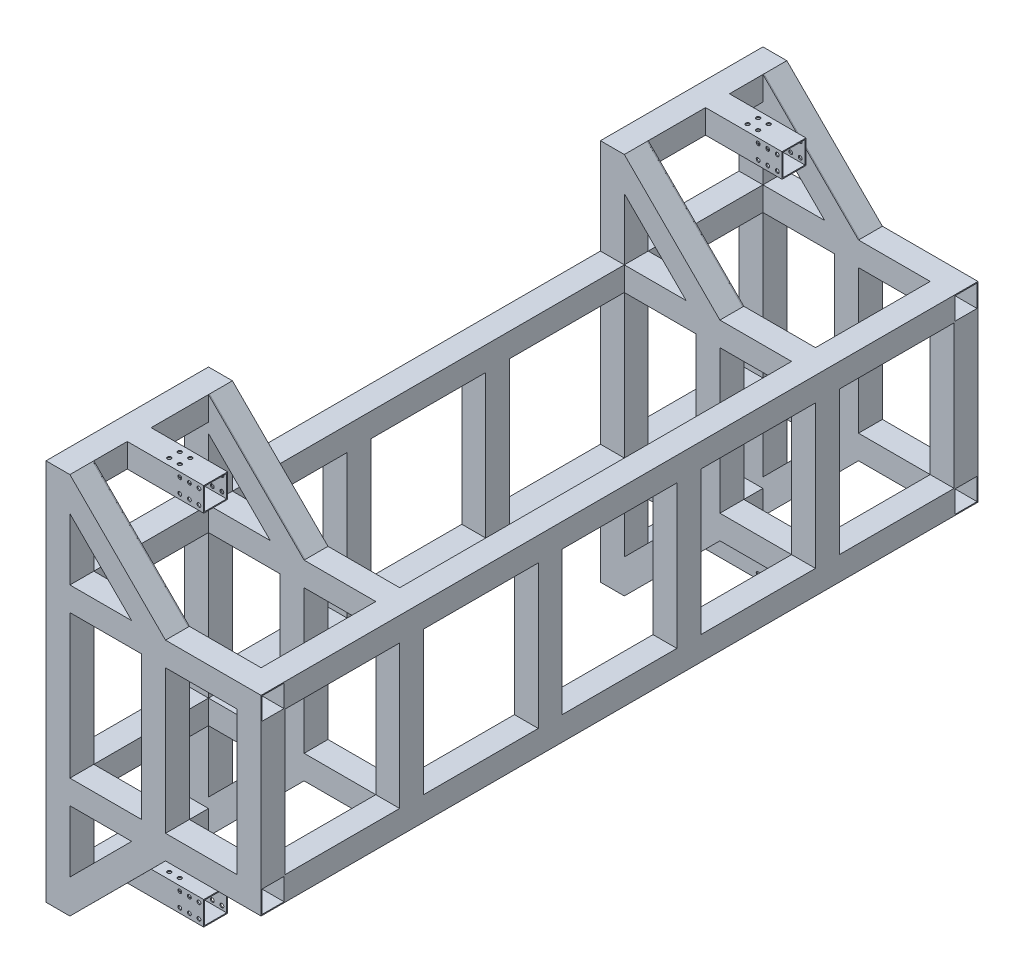
from build123d import *

# Parameters (mm, degrees)
BOSS_EXTRUDE1_DEPTH        = 100
BOSS_EXTRUDE1_DEPTH_BACK   = 125
SKETCH1_W                  = 25
SKETCH1_H                  = 25
SKETCH1_W_2                = 23
SKETCH1_H_2                = 23
BOSS_EXTRUDE1_2_DEPTH      = 100
BOSS_EXTRUDE1_2_DEPTH_BACK = 125
BOSS_EXTRUDE1_3_DEPTH      = 100
BOSS_EXTRUDE1_3_DEPTH_BACK = 125
BOSS_EXTRUDE1_4_DEPTH      = 100
BOSS_EXTRUDE1_4_DEPTH_BACK = 125
SKETCH2_W                  = 25
SKETCH2_H                  = 25
SKETCH2_W_2                = 23
SKETCH2_H_2                = 23
BOSS_EXTRUDE2_DEPTH        = 150
SKETCH3_W                  = 25
SKETCH3_H                  = 25
SKETCH3_W_2                = 23
SKETCH3_H_2                = 23
BOSS_EXTRUDE3_DEPTH        = 700
SKETCH4_W                  = 25
SKETCH4_H                  = 25
SKETCH4_W_2                = 23
SKETCH4_H_2                = 23
BOSS_EXTRUDE4_DEPTH        = 175
SKETCH5_W                  = 25
SKETCH5_H                  = 25
SKETCH5_W_2                = 23
SKETCH5_H_2                = 23
BOSS_EXTRUDE5_DEPTH        = 100
SKETCH6_W                  = 25
SKETCH6_H                  = 25
SKETCH6_W_2                = 23
SKETCH6_H_2                = 23
BOSS_EXTRUDE6_DEPTH        = 100
SKETCH7_W                  = 25
SKETCH7_H                  = 25
SKETCH7_W_2                = 23
SKETCH7_H_2                = 23
BOSS_EXTRUDE7_DEPTH        = 120
SKETCH8_W                  = 25
SKETCH8_H                  = 25
SKETCH8_W_2                = 23
SKETCH8_H_2                = 23
BOSS_EXTRUDE8_DEPTH        = 80
SKETCH10_R                 = 2
CUT_EXTRUDE1_DEPTH         = 25
SKETCH20_R                 = 2
CUT_EXTRUDE3_DEPTH         = 25
SKETCH21_W                 = 100
SKETCH21_H                 = 100
CUT_EXTRUDE5_DEPTH         = 25
SKETCH18_W                 = 25
SKETCH18_H                 = 25
SKETCH18_W_2               = 23
SKETCH18_H_2               = 23
BOSS_EXTRUDE21_DEPTH       = 150
MIRROR2_COPY_1_SKETCH_W    = 100
MIRROR2_COPY_1_SKETCH_H    = 100
MIRROR2_COPY_1_DEPTH       = 25
MIRROR3_COPY_1_SKETCH_W    = 100
MIRROR3_COPY_1_SKETCH_H    = 100
MIRROR3_COPY_1_DEPTH       = 25
MIRROR3_COPY_2_SKETCH_W    = 25
MIRROR3_COPY_2_SKETCH_H    = 25
MIRROR3_COPY_2_SKETCH_W_2  = 23
MIRROR3_COPY_2_SKETCH_H_2  = 23
MIRROR3_COPY_2_DEPTH       = 700
MIRROR3_COPY_3_SKETCH_W    = 25
MIRROR3_COPY_3_SKETCH_H    = 25
MIRROR3_COPY_3_SKETCH_W_2  = 23
MIRROR3_COPY_3_SKETCH_H_2  = 23
MIRROR3_COPY_3_DEPTH       = 175
MIRROR3_COPY_4_SKETCH_W    = 25
MIRROR3_COPY_4_SKETCH_H    = 25
MIRROR3_COPY_4_SKETCH_W_2  = 23
MIRROR3_COPY_4_SKETCH_H_2  = 23
MIRROR3_COPY_4_DEPTH       = 100
MIRROR3_COPY_5_SKETCH_W    = 25
MIRROR3_COPY_5_SKETCH_H    = 25
MIRROR3_COPY_5_SKETCH_W_2  = 23
MIRROR3_COPY_5_SKETCH_H_2  = 23
MIRROR3_COPY_5_DEPTH       = 100
MIRROR3_COPY_6_SKETCH_W    = 25
MIRROR3_COPY_6_SKETCH_H    = 25
MIRROR3_COPY_6_SKETCH_W_2  = 23
MIRROR3_COPY_6_SKETCH_H_2  = 23
MIRROR3_COPY_6_DEPTH       = 120
MIRROR3_COPY_7_SKETCH_W    = 25
MIRROR3_COPY_7_SKETCH_H    = 25
MIRROR3_COPY_7_SKETCH_W_2  = 23
MIRROR3_COPY_7_SKETCH_H_2  = 23
MIRROR3_COPY_7_DEPTH       = 80
MIRROR3_COPY_8_SKETCH_R    = 2
MIRROR3_COPY_8_DEPTH       = 25
MIRROR3_COPY_9_SKETCH_R    = 2
MIRROR3_COPY_9_DEPTH       = 25
MIRROR3_COPY_10_SKETCH_W   = 100
MIRROR3_COPY_10_SKETCH_H   = 100
MIRROR3_COPY_10_DEPTH      = 25
MIRROR3_COPY_11_SKETCH_W   = 100
MIRROR3_COPY_11_SKETCH_H   = 100
MIRROR3_COPY_11_DEPTH      = 25
MIRROR3_COPY_12_SKETCH_W   = 25
MIRROR3_COPY_12_SKETCH_H   = 25
MIRROR3_COPY_12_SKETCH_W_2 = 23
MIRROR3_COPY_12_SKETCH_H_2 = 23
MIRROR3_COPY_12_DEPTH      = 700
SKETCH19_W                 = 25
SKETCH19_H                 = 25
SKETCH19_W_2               = 23
SKETCH19_H_2               = 23
BOSS_EXTRUDE22_DEPTH       = 150
BOSS_EXTRUDE23_DEPTH       = 1
BOSS_EXTRUDE24_DEPTH       = 1
BOSS_EXTRUDE25_DEPTH       = 23
MIRROR5_COPY_1_DEPTH       = 1
MIRROR5_COPY_2_DEPTH       = 1
MIRROR5_COPY_3_DEPTH       = 23
MIRROR6_COPY_1_DEPTH       = 1
MIRROR6_COPY_2_DEPTH       = 1
MIRROR6_COPY_3_DEPTH       = 23
MIRROR6_COPY_4_DEPTH       = 1
MIRROR6_COPY_5_DEPTH       = 1
MIRROR6_COPY_6_DEPTH       = 23
MIRROR6_COPY_7_DEPTH       = 1
MIRROR6_COPY_8_DEPTH       = 1
MIRROR6_COPY_9_DEPTH       = 23


with BuildPart() as part:
    # Sketch1 → Boss-Extrude1 (new, two sides: drawn at the far end of the back side and taken through both)
    with BuildSketch(Plane(origin=(0, 0, 0), x_dir=(0, 0, -1), z_dir=(1, 0, 0)).offset(-BOSS_EXTRUDE1_DEPTH_BACK)):
        with Locations((-362.5, 87.5)):
            Rectangle(SKETCH1_W, SKETCH1_H)
        with Locations((-362.5, 87.5)):
            Rectangle(SKETCH1_W_2, SKETCH1_H_2, mode=Mode.SUBTRACT)
    extrude(amount=BOSS_EXTRUDE1_DEPTH + BOSS_EXTRUDE1_DEPTH_BACK)



with BuildPart() as body_2:
    # Sketch1 → Boss-Extrude1 2 (new, two sides: drawn at the far end of the back side and taken through both)
    with BuildSketch(Plane(origin=(0, 0, 0), x_dir=(0, 0, -1), z_dir=(1, 0, 0)).offset(-BOSS_EXTRUDE1_2_DEPTH_BACK)):
        with Locations((362.5, 87.5)):
            Rectangle(SKETCH1_W, SKETCH1_H)
        with Locations((362.5, 87.5)):
            Rectangle(SKETCH1_W_2, SKETCH1_H_2, mode=Mode.SUBTRACT)
    extrude(amount=BOSS_EXTRUDE1_2_DEPTH + BOSS_EXTRUDE1_2_DEPTH_BACK)


with BuildPart() as body_3:
    # Sketch1 → Boss-Extrude1 3 (new, two sides: drawn at the far end of the back side and taken through both)
    with BuildSketch(Plane(origin=(0, 0, 0), x_dir=(0, 0, -1), z_dir=(1, 0, 0)).offset(-BOSS_EXTRUDE1_3_DEPTH_BACK)):
        with Locations((362.5, -87.5)):
            Rectangle(SKETCH1_W, SKETCH1_H)
        with Locations((362.5, -87.5)):
            Rectangle(SKETCH1_W_2, SKETCH1_H_2, mode=Mode.SUBTRACT)
    extrude(amount=BOSS_EXTRUDE1_3_DEPTH + BOSS_EXTRUDE1_3_DEPTH_BACK)


with BuildPart() as body_4:
    # Sketch1 → Boss-Extrude1 4 (new, two sides: drawn at the far end of the back side and taken through both)
    with BuildSketch(Plane(origin=(0, 0, 0), x_dir=(0, 0, -1), z_dir=(1, 0, 0)).offset(-BOSS_EXTRUDE1_4_DEPTH_BACK)):
        with Locations((-362.5, -87.5)):
            Rectangle(SKETCH1_W, SKETCH1_H)
        with Locations((-362.5, -87.5)):
            Rectangle(SKETCH1_W_2, SKETCH1_H_2, mode=Mode.SUBTRACT)
    extrude(amount=BOSS_EXTRUDE1_4_DEPTH + BOSS_EXTRUDE1_4_DEPTH_BACK)


with BuildPart() as part_1:
    add(part.part)

    add(body_2.part)  # Boss-Extrude2 merges body 2

    add(body_3.part)  # Boss-Extrude2 merges body 3

    add(body_4.part)  # Boss-Extrude2 merges body 4
    # Sketch2 → Boss-Extrude2 (add)
    # profile 1 of 4: a face of its own
    with BuildSketch(Plane.XZ.offset(-75)):
        with Locations((-112.5, -362.5)):
            Rectangle(SKETCH2_W, SKETCH2_H)
        with Locations((-112.5, -362.5)):
            Rectangle(SKETCH2_W_2, SKETCH2_H_2, mode=Mode.SUBTRACT)
    # profile 2 of 4: a face of its own
    with BuildSketch(Plane.XZ.offset(-75)):
        with Locations((-112.5, 362.5)):
            Rectangle(SKETCH2_W, SKETCH2_H)
        with Locations((-112.5, 362.5)):
            Rectangle(SKETCH2_W_2, SKETCH2_H_2, mode=Mode.SUBTRACT)
    # profile 3 of 4: a face of its own
    with BuildSketch(Plane.XZ.offset(-75)):
        with Locations((87.5, -362.5)):
            Rectangle(SKETCH2_W, SKETCH2_H)
        with Locations((87.5, -362.5)):
            Rectangle(SKETCH2_W_2, SKETCH2_H_2, mode=Mode.SUBTRACT)
    # profile 4 of 4: a face of its own
    with BuildSketch(Plane.XZ.offset(-75)):
        with Locations((87.5, 362.5)):
            Rectangle(SKETCH2_W, SKETCH2_H)
        with Locations((87.5, 362.5)):
            Rectangle(SKETCH2_W_2, SKETCH2_H_2, mode=Mode.SUBTRACT)
    extrude(amount=BOSS_EXTRUDE2_DEPTH)

    # Sketch3 → Boss-Extrude3 (add)
    # profile 1 of 4: a face of its own
    with BuildSketch(Plane.XY.offset(-350)):
        with Locations((-112.5, 87.5)):
            Rectangle(SKETCH3_W, SKETCH3_H)
        with Locations((-112.5, 87.5)):
            Rectangle(SKETCH3_W_2, SKETCH3_H_2, mode=Mode.SUBTRACT)
    # profile 2 of 4: a face of its own
    with BuildSketch(Plane.XY.offset(-350)):
        with Locations((-112.5, -87.5)):
            Rectangle(SKETCH3_W, SKETCH3_H)
        with Locations((-112.5, -87.5)):
            Rectangle(SKETCH3_W_2, SKETCH3_H_2, mode=Mode.SUBTRACT)
    # profile 3 of 4: a face of its own
    with BuildSketch(Plane.XY.offset(-350)):
        with Locations((87.5, -87.5)):
            Rectangle(SKETCH3_W, SKETCH3_H)
        with Locations((87.5, -87.5)):
            Rectangle(SKETCH3_W_2, SKETCH3_H_2, mode=Mode.SUBTRACT)
    # profile 4 of 4: a face of its own
    with BuildSketch(Plane.XY.offset(-350)):
        with Locations((87.5, 87.5)):
            Rectangle(SKETCH3_W, SKETCH3_H)
        with Locations((87.5, 87.5)):
            Rectangle(SKETCH3_W_2, SKETCH3_H_2, mode=Mode.SUBTRACT)
    boss_extrude3 = extrude(amount=BOSS_EXTRUDE3_DEPTH)

    # Sketch4 → Boss-Extrude4 (add)
    with BuildSketch(Plane.ZY.offset(-75)):
        with Locations((-217.5, -87.5)):
            Rectangle(SKETCH4_W, SKETCH4_H)
        with Locations((-217.5, -87.5)):
            Rectangle(SKETCH4_W_2, SKETCH4_H_2, mode=Mode.SUBTRACT)
    boss_extrude4 = extrude(amount=BOSS_EXTRUDE4_DEPTH)

    # Sketch5 → Boss-Extrude5 (add)
    # profile 1 of 4: a face of its own
    with BuildSketch(Plane.XZ.offset(100)):
        with Locations((-112.5, -217.5)):
            Rectangle(SKETCH5_W, SKETCH5_H)
        with Locations((-112.5, -217.5)):
            Rectangle(SKETCH5_W_2, SKETCH5_H_2, mode=Mode.SUBTRACT)
    # profile 2 of 4: a face of its own
    with BuildSketch(Plane.XZ.offset(100)):
        with Locations((-112.5, -362.5)):
            Rectangle(SKETCH5_W, SKETCH5_H)
        with Locations((-112.5, -362.5)):
            Rectangle(SKETCH5_W_2, SKETCH5_H_2, mode=Mode.SUBTRACT)
    # profile 3 of 4: a face of its own
    with BuildSketch(Plane.XZ.offset(100)):
        with Locations((-12.5, -362.5)):
            Rectangle(SKETCH5_W, SKETCH5_H)
        with Locations((-12.5, -362.5)):
            Rectangle(SKETCH5_W_2, SKETCH5_H_2, mode=Mode.SUBTRACT)
    # profile 4 of 4: a face of its own
    with BuildSketch(Plane.XZ.offset(100)):
        with Locations((-12.5, -217.5)):
            Rectangle(SKETCH5_W, SKETCH5_H)
        with Locations((-12.5, -217.5)):
            Rectangle(SKETCH5_W_2, SKETCH5_H_2, mode=Mode.SUBTRACT)
    boss_extrude5 = extrude(amount=BOSS_EXTRUDE5_DEPTH)

    # Sketch6 → Boss-Extrude6 (add)
    # profile 1 of 2: a face of its own
    with BuildSketch(Plane.ZY.offset(25)):
        with Locations((-362.5, -187.5)):
            Rectangle(SKETCH6_W, SKETCH6_H)
        with Locations((-362.5, -187.5)):
            Rectangle(SKETCH6_W_2, SKETCH6_H_2, mode=Mode.SUBTRACT)
    # profile 2 of 2: a face of its own
    with BuildSketch(Plane.ZY.offset(25)):
        with Locations((-217.5, -187.5)):
            Rectangle(SKETCH6_W, SKETCH6_H)
        with Locations((-217.5, -187.5)):
            Rectangle(SKETCH6_W_2, SKETCH6_H_2, mode=Mode.SUBTRACT)
    boss_extrude6 = extrude(amount=BOSS_EXTRUDE6_DEPTH)

    # Sketch7 → Boss-Extrude7 (add)
    with BuildSketch(Plane.XY.offset(-350)):
        with Locations((-112.5, -187.5)):
            Rectangle(SKETCH7_W, SKETCH7_H)
        with Locations((-112.5, -187.5)):
            Rectangle(SKETCH7_W_2, SKETCH7_H_2, mode=Mode.SUBTRACT)
    boss_extrude7 = extrude(amount=BOSS_EXTRUDE7_DEPTH)

    # Sketch8 → Boss-Extrude8 (add)
    with BuildSketch(Plane(origin=(-100, 0, 0), x_dir=(0, 0, -1), z_dir=(1, 0, 0))):
        with Locations((302.5, -187.5)):
            Rectangle(SKETCH8_W, SKETCH8_H)
        with Locations((302.5, -187.5)):
            Rectangle(SKETCH8_W_2, SKETCH8_H_2, mode=Mode.SUBTRACT)
    boss_extrude8 = extrude(amount=BOSS_EXTRUDE8_DEPTH)

    # Sketch10 → Cut-Extrude1 (cut)
    with BuildSketch(Plane(origin=(0, 0, -315), x_dir=(-1, 0, 0), z_dir=(0, 0, -1))):
        with Locations((25, -180)):
            Circle(SKETCH10_R)
        with Locations((25, -195)):
            Circle(SKETCH10_R)
        with Locations((35, -195)):
            Circle(SKETCH10_R)
        with Locations((35, -180)):
            Circle(SKETCH10_R)
        with Locations((45, -180)):
            Circle(SKETCH10_R)
        with Locations((45, -195)):
            Circle(SKETCH10_R)
    cut_extrude1 = extrude(amount=-CUT_EXTRUDE1_DEPTH, mode=Mode.SUBTRACT)

    # Sketch20 → Cut-Extrude3 (cut)
    with BuildSketch(Plane.XZ.offset(200)):
        with Locations(Location((-63, -297, 0), (0, 0, 270))):
            Circle(SKETCH20_R)
        with Locations(Location((-63, -308, 0), (0, 0, 270))):
            Circle(SKETCH20_R)
        with Locations(Location((-52, -297, 0), (0, 0, 270))):
            Circle(SKETCH20_R)
        with Locations(Location((-52, -308, 0), (0, 0, 270))):
            Circle(SKETCH20_R)
    cut_extrude3 = extrude(amount=-CUT_EXTRUDE3_DEPTH, mode=Mode.SUBTRACT)

    # Sketch21 → Cut-Extrude5 (cut)
    with BuildSketch(Plane(origin=(0, 0, -375), x_dir=(-1, 0, 0), z_dir=(0, 0, -1))):
        with Locations((50, -150)):
            Rectangle(SKETCH21_W, SKETCH21_H)
    cut_extrude5 = extrude(amount=-CUT_EXTRUDE5_DEPTH, mode=Mode.SUBTRACT)

    # Sketch18 → Boss-Extrude21 (add)
    # profile 1 of 8: a face of its own
    with BuildSketch(Plane(origin=(0, -75, 0), x_dir=(1, 0, 0), z_dir=(0, 1, 0))):
        with Locations((-112.5, -217.5)):
            Rectangle(SKETCH18_W, SKETCH18_H)
        with Locations((-112.5, -217.5)):
            Rectangle(SKETCH18_W_2, SKETCH18_H_2, mode=Mode.SUBTRACT)
    # profile 2 of 8: a face of its own
    with BuildSketch(Plane(origin=(0, -75, 0), x_dir=(1, 0, 0), z_dir=(0, 1, 0))):
        with Locations((-112.5, -72.5)):
            Rectangle(SKETCH18_W, SKETCH18_H)
        with Locations((-112.5, -72.5)):
            Rectangle(SKETCH18_W_2, SKETCH18_H_2, mode=Mode.SUBTRACT)
    # profile 3 of 8: a face of its own
    with BuildSketch(Plane(origin=(0, -75, 0), x_dir=(1, 0, 0), z_dir=(0, 1, 0))):
        with Locations((-112.5, 72.5)):
            Rectangle(SKETCH18_W, SKETCH18_H)
        with Locations((-112.5, 72.5)):
            Rectangle(SKETCH18_W_2, SKETCH18_H_2, mode=Mode.SUBTRACT)
    # profile 4 of 8: a face of its own
    with BuildSketch(Plane(origin=(0, -75, 0), x_dir=(1, 0, 0), z_dir=(0, 1, 0))):
        with Locations((-112.5, 217.5)):
            Rectangle(SKETCH18_W, SKETCH18_H)
        with Locations((-112.5, 217.5)):
            Rectangle(SKETCH18_W_2, SKETCH18_H_2, mode=Mode.SUBTRACT)
    # profile 5 of 8: a face of its own
    with BuildSketch(Plane(origin=(0, -75, 0), x_dir=(1, 0, 0), z_dir=(0, 1, 0))):
        with Locations((87.5, -217.5)):
            Rectangle(SKETCH18_W, SKETCH18_H)
        with Locations((87.5, -217.5)):
            Rectangle(SKETCH18_W_2, SKETCH18_H_2, mode=Mode.SUBTRACT)
    # profile 6 of 8: a face of its own
    with BuildSketch(Plane(origin=(0, -75, 0), x_dir=(1, 0, 0), z_dir=(0, 1, 0))):
        with Locations((87.5, -72.5)):
            Rectangle(SKETCH18_W, SKETCH18_H)
        with Locations((87.5, -72.5)):
            Rectangle(SKETCH18_W_2, SKETCH18_H_2, mode=Mode.SUBTRACT)
    # profile 7 of 8: a face of its own
    with BuildSketch(Plane(origin=(0, -75, 0), x_dir=(1, 0, 0), z_dir=(0, 1, 0))):
        with Locations((87.5, 72.5)):
            Rectangle(SKETCH18_W, SKETCH18_H)
        with Locations((87.5, 72.5)):
            Rectangle(SKETCH18_W_2, SKETCH18_H_2, mode=Mode.SUBTRACT)
    # profile 8 of 8: a face of its own
    with BuildSketch(Plane(origin=(0, -75, 0), x_dir=(1, 0, 0), z_dir=(0, 1, 0))):
        with Locations((87.5, 217.5)):
            Rectangle(SKETCH18_W, SKETCH18_H)
        with Locations((87.5, 217.5)):
            Rectangle(SKETCH18_W_2, SKETCH18_H_2, mode=Mode.SUBTRACT)
    extrude(amount=BOSS_EXTRUDE21_DEPTH)

    # Mirror1: Cut-Extrude5 across plane
    add(cut_extrude5.mirror(Plane.XY.offset(-290)), mode=Mode.SUBTRACT)

    # Mirror2: Boss-Extrude3, Boss-Extrude4, Boss-Extrude5, Boss-Extrude6, Boss-Extrude7, Boss-Extrude8, Cut-Extrude1, Cut-Extrude3, Cut-Extrude5 across plane
    add(boss_extrude3.mirror(Plane.ZX))
    add(boss_extrude4.mirror(Plane.ZX))
    add(boss_extrude5.mirror(Plane.ZX))
    add(boss_extrude6.mirror(Plane.ZX))
    add(boss_extrude7.mirror(Plane.ZX))
    add(boss_extrude8.mirror(Plane.ZX))
    add(cut_extrude1.mirror(Plane.ZX), mode=Mode.SUBTRACT)
    add(cut_extrude3.mirror(Plane.ZX), mode=Mode.SUBTRACT)
    add(cut_extrude5.mirror(Plane.ZX), mode=Mode.SUBTRACT)

    # Mirror2 copy 1 sketch → Mirror2 copy 1 (cut)
    with BuildSketch(Plane(origin=(0, 0, -205), x_dir=(-1, 0, 0), z_dir=(0, 0, 1))):
        with Locations((50, -150)):
            Rectangle(MIRROR2_COPY_1_SKETCH_W, MIRROR2_COPY_1_SKETCH_H)
    extrude(amount=-MIRROR2_COPY_1_DEPTH, mode=Mode.SUBTRACT)

    # Mirror3: Boss-Extrude4, Boss-Extrude5, Boss-Extrude6, Boss-Extrude7, Boss-Extrude8, Cut-Extrude1, Cut-Extrude3, Cut-Extrude5 across plane
    add(boss_extrude4.mirror(Plane.XY))
    add(boss_extrude5.mirror(Plane.XY))
    add(boss_extrude6.mirror(Plane.XY))
    add(boss_extrude7.mirror(Plane.XY))
    add(boss_extrude8.mirror(Plane.XY))
    add(cut_extrude1.mirror(Plane.XY), mode=Mode.SUBTRACT)
    add(cut_extrude3.mirror(Plane.XY), mode=Mode.SUBTRACT)
    add(cut_extrude5.mirror(Plane.XY), mode=Mode.SUBTRACT)

    # Mirror3 copy 1 sketch → Mirror3 copy 1 (cut)
    with BuildSketch(Plane(origin=(0, 0, 205), x_dir=(-1, 0, 0), z_dir=(0, 0, -1))):
        with Locations((50, -150)):
            Rectangle(MIRROR3_COPY_1_SKETCH_W, MIRROR3_COPY_1_SKETCH_H)
    extrude(amount=-MIRROR3_COPY_1_DEPTH, mode=Mode.SUBTRACT)

    # Mirror3 copy 2 sketch → Mirror3 copy 2 (add)
    # profile 1 of 4: a face of its own
    with BuildSketch(Plane(origin=(0, 0, 350), x_dir=(1, 0, 0), z_dir=(0, 0, -1))):
        with Locations((-112.5, 87.5)):
            Rectangle(MIRROR3_COPY_2_SKETCH_W, MIRROR3_COPY_2_SKETCH_H)
        with Locations((-112.5, 87.5)):
            Rectangle(MIRROR3_COPY_2_SKETCH_W_2, MIRROR3_COPY_2_SKETCH_H_2, mode=Mode.SUBTRACT)
    # profile 2 of 4: a face of its own
    with BuildSketch(Plane(origin=(0, 0, 350), x_dir=(1, 0, 0), z_dir=(0, 0, -1))):
        with Locations((-112.5, -87.5)):
            Rectangle(MIRROR3_COPY_2_SKETCH_W, MIRROR3_COPY_2_SKETCH_H)
        with Locations((-112.5, -87.5)):
            Rectangle(MIRROR3_COPY_2_SKETCH_W_2, MIRROR3_COPY_2_SKETCH_H_2, mode=Mode.SUBTRACT)
    # profile 3 of 4: a face of its own
    with BuildSketch(Plane(origin=(0, 0, 350), x_dir=(1, 0, 0), z_dir=(0, 0, -1))):
        with Locations((87.5, -87.5)):
            Rectangle(MIRROR3_COPY_2_SKETCH_W, MIRROR3_COPY_2_SKETCH_H)
        with Locations((87.5, -87.5)):
            Rectangle(MIRROR3_COPY_2_SKETCH_W_2, MIRROR3_COPY_2_SKETCH_H_2, mode=Mode.SUBTRACT)
    # profile 4 of 4: a face of its own
    with BuildSketch(Plane(origin=(0, 0, 350), x_dir=(1, 0, 0), z_dir=(0, 0, -1))):
        with Locations((87.5, 87.5)):
            Rectangle(MIRROR3_COPY_2_SKETCH_W, MIRROR3_COPY_2_SKETCH_H)
        with Locations((87.5, 87.5)):
            Rectangle(MIRROR3_COPY_2_SKETCH_W_2, MIRROR3_COPY_2_SKETCH_H_2, mode=Mode.SUBTRACT)
    extrude(amount=MIRROR3_COPY_2_DEPTH)

    # Mirror3 copy 3 sketch → Mirror3 copy 3 (add)
    with BuildSketch(Plane(origin=(75, 0, 0), x_dir=(0, 0, -1), z_dir=(-1, 0, 0))):
        with Locations((-217.5, -87.5)):
            Rectangle(MIRROR3_COPY_3_SKETCH_W, MIRROR3_COPY_3_SKETCH_H)
        with Locations((-217.5, -87.5)):
            Rectangle(MIRROR3_COPY_3_SKETCH_W_2, MIRROR3_COPY_3_SKETCH_H_2, mode=Mode.SUBTRACT)
    extrude(amount=MIRROR3_COPY_3_DEPTH)

    # Mirror3 copy 4 sketch → Mirror3 copy 4 (add)
    # profile 1 of 4: a face of its own
    with BuildSketch(Plane(origin=(0, 100, 0), x_dir=(1, 0, 0), z_dir=(0, 1, 0))):
        with Locations((-112.5, -217.5)):
            Rectangle(MIRROR3_COPY_4_SKETCH_W, MIRROR3_COPY_4_SKETCH_H)
        with Locations((-112.5, -217.5)):
            Rectangle(MIRROR3_COPY_4_SKETCH_W_2, MIRROR3_COPY_4_SKETCH_H_2, mode=Mode.SUBTRACT)
    # profile 2 of 4: a face of its own
    with BuildSketch(Plane(origin=(0, 100, 0), x_dir=(1, 0, 0), z_dir=(0, 1, 0))):
        with Locations((-112.5, -362.5)):
            Rectangle(MIRROR3_COPY_4_SKETCH_W, MIRROR3_COPY_4_SKETCH_H)
        with Locations((-112.5, -362.5)):
            Rectangle(MIRROR3_COPY_4_SKETCH_W_2, MIRROR3_COPY_4_SKETCH_H_2, mode=Mode.SUBTRACT)
    # profile 3 of 4: a face of its own
    with BuildSketch(Plane(origin=(0, 100, 0), x_dir=(1, 0, 0), z_dir=(0, 1, 0))):
        with Locations((-12.5, -362.5)):
            Rectangle(MIRROR3_COPY_4_SKETCH_W, MIRROR3_COPY_4_SKETCH_H)
        with Locations((-12.5, -362.5)):
            Rectangle(MIRROR3_COPY_4_SKETCH_W_2, MIRROR3_COPY_4_SKETCH_H_2, mode=Mode.SUBTRACT)
    # profile 4 of 4: a face of its own
    with BuildSketch(Plane(origin=(0, 100, 0), x_dir=(1, 0, 0), z_dir=(0, 1, 0))):
        with Locations((-12.5, -217.5)):
            Rectangle(MIRROR3_COPY_4_SKETCH_W, MIRROR3_COPY_4_SKETCH_H)
        with Locations((-12.5, -217.5)):
            Rectangle(MIRROR3_COPY_4_SKETCH_W_2, MIRROR3_COPY_4_SKETCH_H_2, mode=Mode.SUBTRACT)
    extrude(amount=MIRROR3_COPY_4_DEPTH)

    # Mirror3 copy 5 sketch → Mirror3 copy 5 (add)
    # profile 1 of 2: a face of its own
    with BuildSketch(Plane(origin=(-25, 0, 0), x_dir=(0, 0, -1), z_dir=(-1, 0, 0))):
        with Locations((-362.5, -187.5)):
            Rectangle(MIRROR3_COPY_5_SKETCH_W, MIRROR3_COPY_5_SKETCH_H)
        with Locations((-362.5, -187.5)):
            Rectangle(MIRROR3_COPY_5_SKETCH_W_2, MIRROR3_COPY_5_SKETCH_H_2, mode=Mode.SUBTRACT)
    # profile 2 of 2: a face of its own
    with BuildSketch(Plane(origin=(-25, 0, 0), x_dir=(0, 0, -1), z_dir=(-1, 0, 0))):
        with Locations((-217.5, -187.5)):
            Rectangle(MIRROR3_COPY_5_SKETCH_W, MIRROR3_COPY_5_SKETCH_H)
        with Locations((-217.5, -187.5)):
            Rectangle(MIRROR3_COPY_5_SKETCH_W_2, MIRROR3_COPY_5_SKETCH_H_2, mode=Mode.SUBTRACT)
    extrude(amount=MIRROR3_COPY_5_DEPTH)

    # Mirror3 copy 6 sketch → Mirror3 copy 6 (add)
    with BuildSketch(Plane(origin=(0, 0, 350), x_dir=(1, 0, 0), z_dir=(0, 0, -1))):
        with Locations((-112.5, -187.5)):
            Rectangle(MIRROR3_COPY_6_SKETCH_W, MIRROR3_COPY_6_SKETCH_H)
        with Locations((-112.5, -187.5)):
            Rectangle(MIRROR3_COPY_6_SKETCH_W_2, MIRROR3_COPY_6_SKETCH_H_2, mode=Mode.SUBTRACT)
    extrude(amount=MIRROR3_COPY_6_DEPTH)

    # Mirror3 copy 7 sketch → Mirror3 copy 7 (add)
    with BuildSketch(Plane(origin=(-100, 0, 0), x_dir=(0, 0, 1), z_dir=(1, 0, 0))):
        with Locations((302.5, -187.5)):
            Rectangle(MIRROR3_COPY_7_SKETCH_W, MIRROR3_COPY_7_SKETCH_H)
        with Locations((302.5, -187.5)):
            Rectangle(MIRROR3_COPY_7_SKETCH_W_2, MIRROR3_COPY_7_SKETCH_H_2, mode=Mode.SUBTRACT)
    extrude(amount=MIRROR3_COPY_7_DEPTH)

    # Mirror3 copy 8 sketch → Mirror3 copy 8 (cut)
    with BuildSketch(Plane(origin=(0, 0, 315), x_dir=(-1, 0, 0), z_dir=(0, 0, 1))):
        with Locations((25, -180)):
            Circle(MIRROR3_COPY_8_SKETCH_R)
        with Locations((25, -195)):
            Circle(MIRROR3_COPY_8_SKETCH_R)
        with Locations((35, -195)):
            Circle(MIRROR3_COPY_8_SKETCH_R)
        with Locations((35, -180)):
            Circle(MIRROR3_COPY_8_SKETCH_R)
        with Locations((45, -180)):
            Circle(MIRROR3_COPY_8_SKETCH_R)
        with Locations((45, -195)):
            Circle(MIRROR3_COPY_8_SKETCH_R)
    extrude(amount=-MIRROR3_COPY_8_DEPTH, mode=Mode.SUBTRACT)

    # Mirror3 copy 9 sketch → Mirror3 copy 9 (cut)
    with BuildSketch(Plane(origin=(0, 200, 0), x_dir=(1, 0, 0), z_dir=(0, 1, 0))):
        with Locations(Location((-63, -297, 0), (0, 0, 270))):
            Circle(MIRROR3_COPY_9_SKETCH_R)
        with Locations(Location((-63, -308, 0), (0, 0, 270))):
            Circle(MIRROR3_COPY_9_SKETCH_R)
        with Locations(Location((-52, -297, 0), (0, 0, 270))):
            Circle(MIRROR3_COPY_9_SKETCH_R)
        with Locations(Location((-52, -308, 0), (0, 0, 270))):
            Circle(MIRROR3_COPY_9_SKETCH_R)
    extrude(amount=-MIRROR3_COPY_9_DEPTH, mode=Mode.SUBTRACT)

    # Mirror3 copy 10 sketch → Mirror3 copy 10 (cut)
    with BuildSketch(Plane(origin=(0, 0, 375), x_dir=(-1, 0, 0), z_dir=(0, 0, 1))):
        with Locations((50, -150)):
            Rectangle(MIRROR3_COPY_10_SKETCH_W, MIRROR3_COPY_10_SKETCH_H)
    extrude(amount=-MIRROR3_COPY_10_DEPTH, mode=Mode.SUBTRACT)

    # Mirror3 copy 11 sketch → Mirror3 copy 11 (cut)
    with BuildSketch(Plane(origin=(0, 0, 205), x_dir=(-1, 0, 0), z_dir=(0, 0, -1))):
        with Locations((50, 150)):
            Rectangle(MIRROR3_COPY_11_SKETCH_W, MIRROR3_COPY_11_SKETCH_H)
    extrude(amount=-MIRROR3_COPY_11_DEPTH, mode=Mode.SUBTRACT)

    # Mirror3 copy 12 sketch → Mirror3 copy 12 (add)
    # profile 1 of 4: a face of its own
    with BuildSketch(Plane(origin=(0, 0, 350), x_dir=(1, 0, 0), z_dir=(0, 0, -1))):
        with Locations((-112.5, -87.5)):
            Rectangle(MIRROR3_COPY_12_SKETCH_W, MIRROR3_COPY_12_SKETCH_H)
        with Locations((-112.5, -87.5)):
            Rectangle(MIRROR3_COPY_12_SKETCH_W_2, MIRROR3_COPY_12_SKETCH_H_2, mode=Mode.SUBTRACT)
    # profile 2 of 4: a face of its own
    with BuildSketch(Plane(origin=(0, 0, 350), x_dir=(1, 0, 0), z_dir=(0, 0, -1))):
        with Locations((-112.5, 87.5)):
            Rectangle(MIRROR3_COPY_12_SKETCH_W, MIRROR3_COPY_12_SKETCH_H)
        with Locations((-112.5, 87.5)):
            Rectangle(MIRROR3_COPY_12_SKETCH_W_2, MIRROR3_COPY_12_SKETCH_H_2, mode=Mode.SUBTRACT)
    # profile 3 of 4: a face of its own
    with BuildSketch(Plane(origin=(0, 0, 350), x_dir=(1, 0, 0), z_dir=(0, 0, -1))):
        with Locations((87.5, 87.5)):
            Rectangle(MIRROR3_COPY_12_SKETCH_W, MIRROR3_COPY_12_SKETCH_H)
        with Locations((87.5, 87.5)):
            Rectangle(MIRROR3_COPY_12_SKETCH_W_2, MIRROR3_COPY_12_SKETCH_H_2, mode=Mode.SUBTRACT)
    # profile 4 of 4: a face of its own
    with BuildSketch(Plane(origin=(0, 0, 350), x_dir=(1, 0, 0), z_dir=(0, 0, -1))):
        with Locations((87.5, -87.5)):
            Rectangle(MIRROR3_COPY_12_SKETCH_W, MIRROR3_COPY_12_SKETCH_H)
        with Locations((87.5, -87.5)):
            Rectangle(MIRROR3_COPY_12_SKETCH_W_2, MIRROR3_COPY_12_SKETCH_H_2, mode=Mode.SUBTRACT)
    extrude(amount=MIRROR3_COPY_12_DEPTH)

    # Sketch19 → Boss-Extrude22 (add)
    # profile 1 of 4: a face of its own
    with BuildSketch(Plane.XZ.offset(-75)):
        with Locations((-12.5, -362.5)):
            Rectangle(SKETCH19_W, SKETCH19_H)
        with Locations((-12.5, -362.5)):
            Rectangle(SKETCH19_W_2, SKETCH19_H_2, mode=Mode.SUBTRACT)
    # profile 2 of 4: a face of its own
    with BuildSketch(Plane.XZ.offset(-75)):
        with Locations((-12.5, -217.5)):
            Rectangle(SKETCH19_W, SKETCH19_H)
        with Locations((-12.5, -217.5)):
            Rectangle(SKETCH19_W_2, SKETCH19_H_2, mode=Mode.SUBTRACT)
    # profile 3 of 4: a face of its own
    with BuildSketch(Plane.XZ.offset(-75)):
        with Locations((-12.5, 217.5)):
            Rectangle(SKETCH19_W, SKETCH19_H)
        with Locations((-12.5, 217.5)):
            Rectangle(SKETCH19_W_2, SKETCH19_H_2, mode=Mode.SUBTRACT)
    # profile 4 of 4: a face of its own
    with BuildSketch(Plane.XZ.offset(-75)):
        with Locations((-12.5, 362.5)):
            Rectangle(SKETCH19_W, SKETCH19_H)
        with Locations((-12.5, 362.5)):
            Rectangle(SKETCH19_W_2, SKETCH19_H_2, mode=Mode.SUBTRACT)
    extrude(amount=BOSS_EXTRUDE22_DEPTH)

    # Sketch22 → Boss-Extrude23 (add)
    with BuildSketch(Plane(origin=(0, 0, -375), x_dir=(-1, 0, 0), z_dir=(0, 0, -1))):
        Polygon((0, -100), (100, -200), (100, -164.644660941), (35.355339059, -100), align=None)
    boss_extrude23 = extrude(amount=-BOSS_EXTRUDE23_DEPTH)

    # Sketch23 → Boss-Extrude24 (add)
    with BuildSketch(Plane.XY.offset(-350)):
        Polygon((-100, -164.681411938), (-100, -200.044643874), (0, -100), (-35.347451465, -100), align=None)
    boss_extrude24 = extrude(amount=-BOSS_EXTRUDE24_DEPTH)

    # Sketch26 → Boss-Extrude25 (add)
    with BuildSketch(Plane(origin=(0, 0, -351), x_dir=(-1, 0, 0), z_dir=(0, 0, -1))):
        Polygon((35.347451465, -100), (100, -164.681411938), (100, -166.095941215), (33.933553406, -100), align=None)
        Polygon((0, -100), (100, -200), (100, -198.585786438), (1.414213562, -100), align=None)
    boss_extrude25 = extrude(amount=BOSS_EXTRUDE25_DEPTH)

    # Mirror4: Boss-Extrude23, Boss-Extrude24, Boss-Extrude25 across plane
    add(boss_extrude23.mirror(Plane.XY.offset(-290)))
    add(boss_extrude24.mirror(Plane.XY.offset(-290)))
    add(boss_extrude25.mirror(Plane.XY.offset(-290)))

    # Mirror5: Boss-Extrude23, Boss-Extrude24, Boss-Extrude25 across plane
    add(boss_extrude23.mirror(Plane.ZX))
    add(boss_extrude24.mirror(Plane.ZX))
    add(boss_extrude25.mirror(Plane.ZX))

    # Mirror5 copy 1 sketch → Mirror5 copy 1 (add)
    with BuildSketch(Plane(origin=(0, 0, -205), x_dir=(-1, 0, 0), z_dir=(0, 0, 1))):
        Polygon((0, -100), (100, -200), (100, -164.644660941), (35.355339059, -100), align=None)
    extrude(amount=-MIRROR5_COPY_1_DEPTH)

    # Mirror5 copy 2 sketch → Mirror5 copy 2 (add)
    with BuildSketch(Plane(origin=(0, 0, -230), x_dir=(1, 0, 0), z_dir=(0, 0, -1))):
        Polygon((-100, -164.681411938), (-100, -200.044643874), (0, -100), (-35.347451465, -100), align=None)
    extrude(amount=-MIRROR5_COPY_2_DEPTH)

    # Mirror5 copy 3 sketch → Mirror5 copy 3 (add)
    with BuildSketch(Plane(origin=(0, 0, -229), x_dir=(-1, 0, 0), z_dir=(0, 0, 1))):
        Polygon((35.347451465, -100), (100, -164.681411938), (100, -166.095941215), (33.933553406, -100), align=None)
        Polygon((0, -100), (100, -200), (100, -198.585786438), (1.414213562, -100), align=None)
    extrude(amount=MIRROR5_COPY_3_DEPTH)

    # Mirror6: Boss-Extrude23, Boss-Extrude24, Boss-Extrude25 across plane
    add(boss_extrude23.mirror(Plane.XY))
    add(boss_extrude24.mirror(Plane.XY))
    add(boss_extrude25.mirror(Plane.XY))

    # Mirror6 copy 1 sketch → Mirror6 copy 1 (add)
    with BuildSketch(Plane(origin=(0, 0, 205), x_dir=(-1, 0, 0), z_dir=(0, 0, -1))):
        Polygon((0, -100), (100, -200), (100, -164.644660941), (35.355339059, -100), align=None)
    extrude(amount=-MIRROR6_COPY_1_DEPTH)

    # Mirror6 copy 2 sketch → Mirror6 copy 2 (add)
    with BuildSketch(Plane.XY.offset(230)):
        Polygon((-100, -164.681411938), (-100, -200.044643874), (0, -100), (-35.347451465, -100), align=None)
    extrude(amount=-MIRROR6_COPY_2_DEPTH)

    # Mirror6 copy 3 sketch → Mirror6 copy 3 (add)
    with BuildSketch(Plane(origin=(0, 0, 229), x_dir=(-1, 0, 0), z_dir=(0, 0, -1))):
        Polygon((35.347451465, -100), (100, -164.681411938), (100, -166.095941215), (33.933553406, -100), align=None)
        Polygon((0, -100), (100, -200), (100, -198.585786438), (1.414213562, -100), align=None)
    extrude(amount=MIRROR6_COPY_3_DEPTH)

    # Mirror6 copy 4 sketch → Mirror6 copy 4 (add)
    with BuildSketch(Plane(origin=(0, 0, 375), x_dir=(-1, 0, 0), z_dir=(0, 0, 1))):
        Polygon((0, -100), (100, -200), (100, -164.644660941), (35.355339059, -100), align=None)
    extrude(amount=-MIRROR6_COPY_4_DEPTH)

    # Mirror6 copy 5 sketch → Mirror6 copy 5 (add)
    with BuildSketch(Plane(origin=(0, 0, 350), x_dir=(1, 0, 0), z_dir=(0, 0, -1))):
        Polygon((-100, -164.681411938), (-100, -200.044643874), (0, -100), (-35.347451465, -100), align=None)
    extrude(amount=-MIRROR6_COPY_5_DEPTH)

    # Mirror6 copy 6 sketch → Mirror6 copy 6 (add)
    with BuildSketch(Plane(origin=(0, 0, 351), x_dir=(-1, 0, 0), z_dir=(0, 0, 1))):
        Polygon((35.347451465, -100), (100, -164.681411938), (100, -166.095941215), (33.933553406, -100), align=None)
        Polygon((0, -100), (100, -200), (100, -198.585786438), (1.414213562, -100), align=None)
    extrude(amount=MIRROR6_COPY_6_DEPTH)

    # Mirror6 copy 7 sketch → Mirror6 copy 7 (add)
    with BuildSketch(Plane(origin=(0, 0, 205), x_dir=(-1, 0, 0), z_dir=(0, 0, -1))):
        Polygon((0, 100), (100, 200), (100, 164.644660941), (35.355339059, 100), align=None)
    extrude(amount=-MIRROR6_COPY_7_DEPTH)

    # Mirror6 copy 8 sketch → Mirror6 copy 8 (add)
    with BuildSketch(Plane.XY.offset(230)):
        Polygon((-100, 164.681411938), (-100, 200.044643874), (0, 100), (-35.347451465, 100), align=None)
    extrude(amount=-MIRROR6_COPY_8_DEPTH)

    # Mirror6 copy 9 sketch → Mirror6 copy 9 (add)
    with BuildSketch(Plane(origin=(0, 0, 229), x_dir=(-1, 0, 0), z_dir=(0, 0, -1))):
        Polygon((35.347451465, 100), (100, 164.681411938), (100, 166.095941215), (33.933553406, 100), align=None)
        Polygon((0, 100), (100, 200), (100, 198.585786438), (1.414213562, 100), align=None)
    extrude(amount=MIRROR6_COPY_9_DEPTH)


solid = part_1.part
